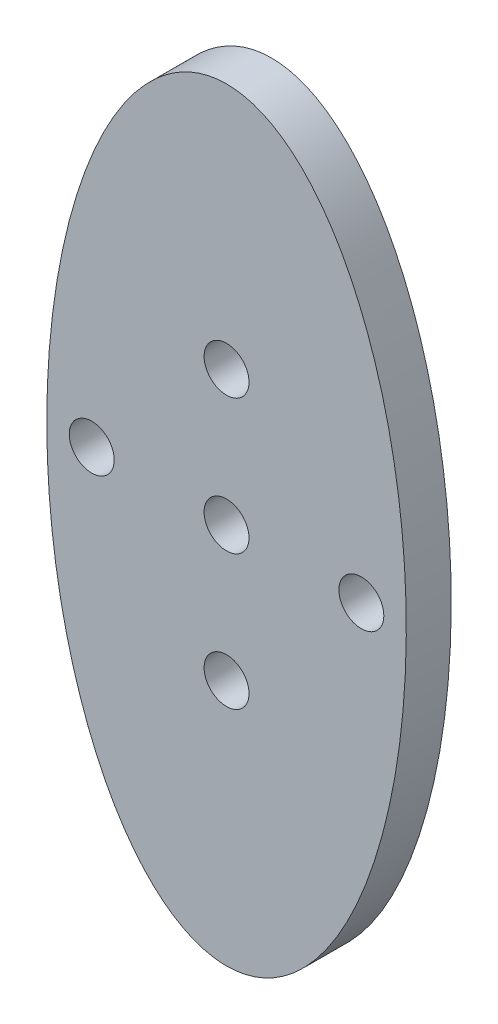
from build123d import *

# Parameters (mm, degrees)
MODEL_RX                = 25.5
MODEL_RY                = 12
MODEL_R                 = 1.5
SALIENTE_EXTRUIR1_DEPTH = 3


with BuildPart() as part:
    # Model → Saliente-Extruir1 (new body)
    with BuildSketch(Plane.XY):
        with Locations(Location((299.518754002, 285.878815596), (0, 0, -90))):
            Ellipse(MODEL_RX, MODEL_RY)
        with Locations((299.518754002, 276.878815596)):
            Circle(MODEL_R, mode=Mode.SUBTRACT)
        with Locations((299.518754002, 294.878815596)):
            Circle(MODEL_R, mode=Mode.SUBTRACT)
        with Locations((308.518754003, 285.878815596)):
            Circle(MODEL_R, mode=Mode.SUBTRACT)
        with Locations((290.518754002, 285.878815596)):
            Circle(MODEL_R, mode=Mode.SUBTRACT)
        with Locations((299.518754002, 285.878815596)):
            Circle(MODEL_R, mode=Mode.SUBTRACT)
    extrude(amount=SALIENTE_EXTRUIR1_DEPTH)


solid = part.part
